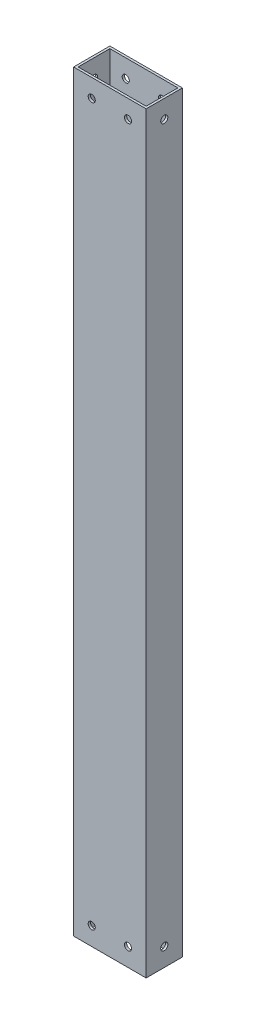
from build123d import *

# Parameters (mm, degrees)
SKETCH1_W               = 50.8
SKETCH1_H               = 527.05
BOSS_EXTRUDE1_DEPTH     = 12.7
SHELL1_T                = -1.5875
CUT_EXTRUDE1_DEPTH      = 266.050703876
CUT_EXTRUDE1_DEPTH_BACK = 266.050703876
SKETCH2_R               = 2.4892
CUT_EXTRUDE2_DEPTH      = 266.050703876
CUT_EXTRUDE2_DEPTH_BACK = 266.050703876
SKETCH3_R               = 2.4892


with BuildPart() as part:
    # Sketch1 → Boss-Extrude1 (new, symmetric)
    with BuildSketch(Plane.XY):
        Rectangle(SKETCH1_W, SKETCH1_H)
    extrude(amount=BOSS_EXTRUDE1_DEPTH, both=True)

    # Shell1
    shell1_openings = [part.faces().sort_by_distance(p)[0] for p in [
        (0, -263.525, 0),
        (0, 263.525, 0),
    ]]
    offset(amount=SHELL1_T, openings=shell1_openings, kind=Kind.INTERSECTION)

    # Sketch2 → Cut-Extrude1 (cut, two sides: drawn at the far end of the back side and taken through both)
    with BuildSketch(Plane.XY.offset(-CUT_EXTRUDE1_DEPTH_BACK)):
        with Locations((-12.7, -250.825)):
            Circle(SKETCH2_R)
        with Locations((12.7, -250.825)):
            Circle(SKETCH2_R)
        with Locations(Location((12.7, 250.825, 0), (0, 0, 180))):
            Circle(SKETCH2_R)
        with Locations(Location((-12.7, 250.825, 0), (0, 0, 180))):
            Circle(SKETCH2_R)
    extrude(amount=CUT_EXTRUDE1_DEPTH + CUT_EXTRUDE1_DEPTH_BACK, mode=Mode.SUBTRACT)

    # Sketch3 → Cut-Extrude2 (cut, two sides: drawn at the far end of the back side and taken through both)
    with BuildSketch(Plane(origin=(0, 0, 0), x_dir=(0, 0, -1), z_dir=(1, 0, 0)).offset(-CUT_EXTRUDE2_DEPTH_BACK)):
        with Locations((0, -250.825)):
            Circle(SKETCH3_R)
        with Locations((0, 250.825)):
            Circle(SKETCH3_R)
    extrude(amount=CUT_EXTRUDE2_DEPTH + CUT_EXTRUDE2_DEPTH_BACK, mode=Mode.SUBTRACT)


solid = part.part
